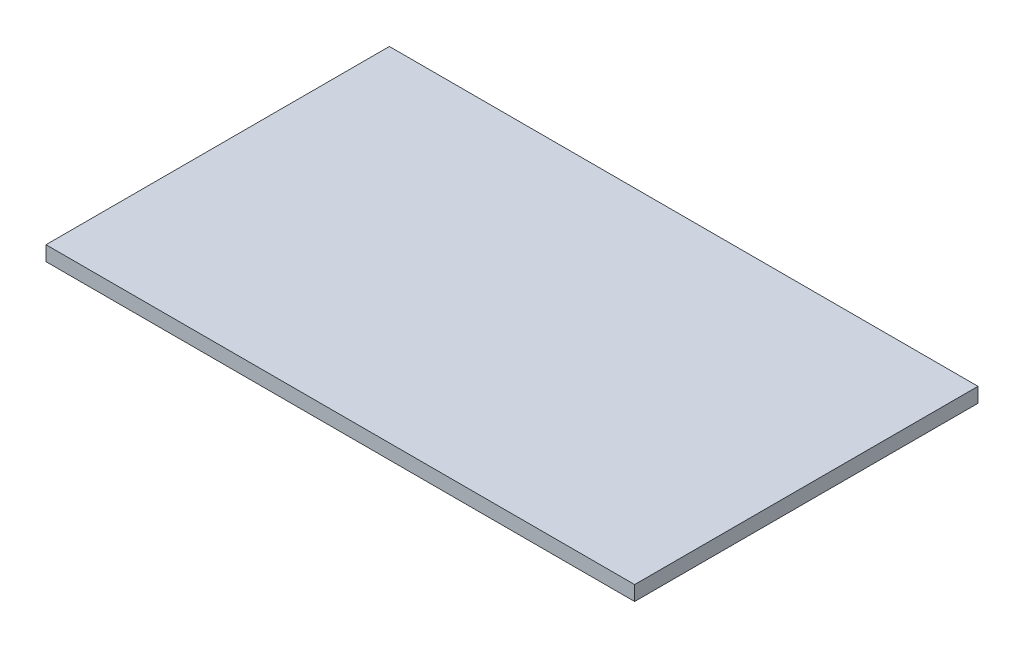
from build123d import *

# Parameters (mm, degrees)
SKETCH2_W           = 120
SKETCH2_H           = 70
BOSS_EXTRUDE1_DEPTH = 3


with BuildPart() as part:
    # Sketch2 → Boss-Extrude1 (new body)
    with BuildSketch(Plane(origin=(0, 0, 0), x_dir=(1, 0, 0), z_dir=(0, 1, 0))):
        with Locations((60, 35)):
            Rectangle(SKETCH2_W, SKETCH2_H)
    extrude(amount=BOSS_EXTRUDE1_DEPTH)


solid = part.part
